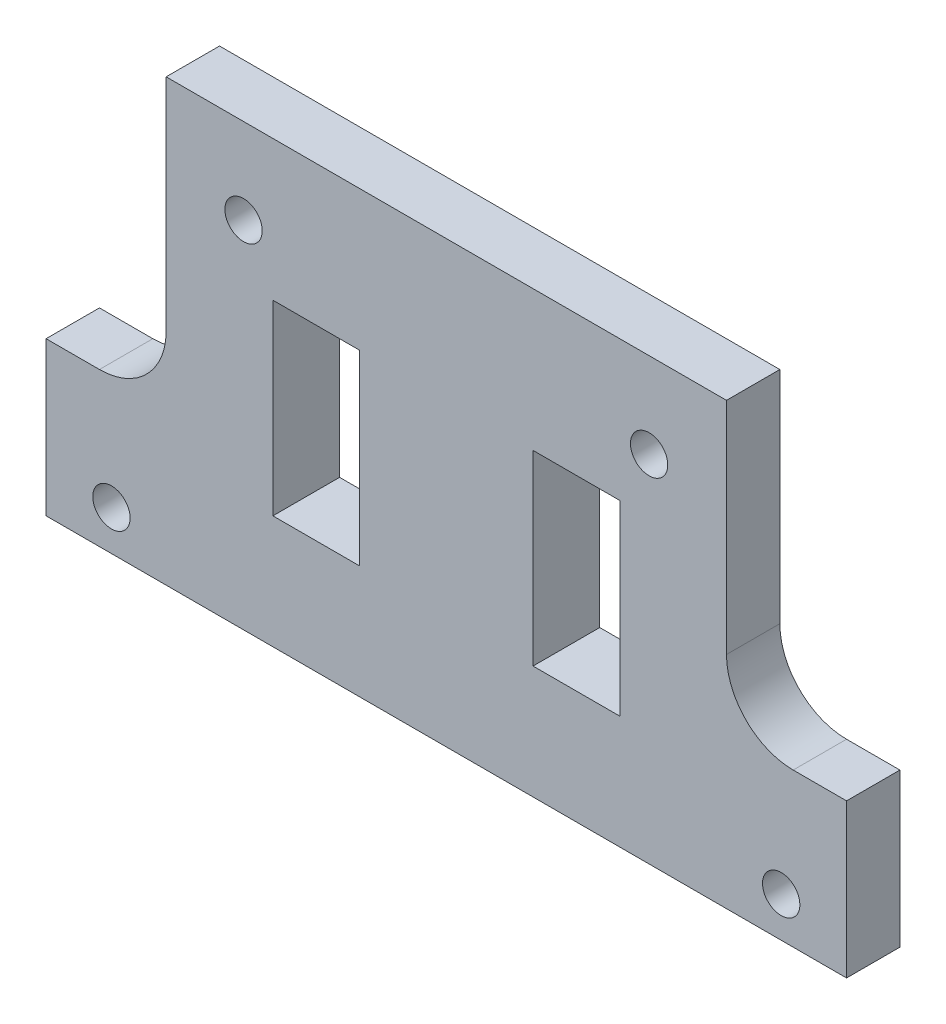
from build123d import *

# Parameters (mm, degrees)
EXTRUDE_1_DEPTH     = 5
SKETCH_2_W          = 6.5
SKETCH_2_H          = 14
CUT_EXTRUDE_1_DEPTH = 5
SKETCH_3_R          = 1.4
CUT_EXTRUDE_2_DEPTH = 45.877611345
FILLET_1_R          = 5
CUT_EXTRUDE_START   = -1
CUT_EXTRUDE_5_DEPTH = 1


with BuildPart() as part:
    # 草图1 → 凸台-拉伸1 (new body)
    with BuildSketch(Plane.XY):
        Polygon((30, 0), (-30, 0), (-30, 11.5), (-21, 11.5), (-21, 33), (21, 33), (21, 11.5), (30, 11.5), align=None)
    extrude(amount=EXTRUDE_1_DEPTH)

    # 草图2 → 切除-拉伸1 (cut)
    with BuildSketch(Plane(origin=(0, 0, 0), x_dir=(-1, 0, 0), z_dir=(0, 0, -1))):
        with Locations((-9.75, 15.5)):
            Rectangle(SKETCH_2_W, SKETCH_2_H)
        with Locations((9.75, 15.5)):
            Rectangle(SKETCH_2_W, SKETCH_2_H)
    extrude(amount=-CUT_EXTRUDE_1_DEPTH, mode=Mode.SUBTRACT)

    # 草图3 → 切除-拉伸2 (cut, through all)
    with BuildSketch(Plane(origin=(0, 0, 0), x_dir=(-1, 0, 0), z_dir=(0, 0, -1))):
        with Locations((-25.1, 3)):
            Circle(SKETCH_3_R)
        with Locations((-15.2, 26.6)):
            Circle(SKETCH_3_R)
        with Locations((25.1, 3)):
            Circle(SKETCH_3_R)
        with Locations((15.2, 26.6)):
            Circle(SKETCH_3_R)
    extrude(amount=-CUT_EXTRUDE_2_DEPTH, mode=Mode.SUBTRACT)

    # 圆角1
    fillet_1_edges = [part.edges().sort_by_distance(p)[0] for p in [
        (-21, 11.5, 2.5),
        (21, 11.5, 2.5),
    ]]
    fillet(fillet_1_edges, radius=FILLET_1_R)

    # 草图5 → 切除-拉伸5 (cut)
    with BuildSketch(Plane(origin=(0, 0, 0), x_dir=(-1, 0, 0), z_dir=(0, 0, -1)).offset(CUT_EXTRUDE_START)):
        with BuildLine():
            Line((21, 33), (-21, 33))
            Line((-21, 33), (-21, 16.5))
            ThreePointArc((-21, 16.5), (-22.464466094, 12.964466094), (-26, 11.5))
            Line((-26, 11.5), (-30, 11.5))
            Line((-30, 11.5), (-30, 0))
            Line((-30, 0), (-28, 0))
            Line((-28, 0), (-28, 10.5))
            Line((-28, 10.5), (-19, 10.5))
            Line((-19, 10.5), (-19, 31))
            Line((-19, 31), (19, 31))
            Line((19, 31), (19, 10.5))
            Line((19, 10.5), (28, 10.5))
            Line((28, 10.5), (28, 0))
            Line((28, 0), (30, 0))
            Line((30, 0), (30, 11.5))
            Line((30, 11.5), (26, 11.5))
            ThreePointArc((26, 11.5), (22.464466094, 12.964466094), (21, 16.5))
            Line((21, 16.5), (21, 33))
        make_face()
    extrude(amount=CUT_EXTRUDE_5_DEPTH, mode=Mode.SUBTRACT)


solid = part.part
